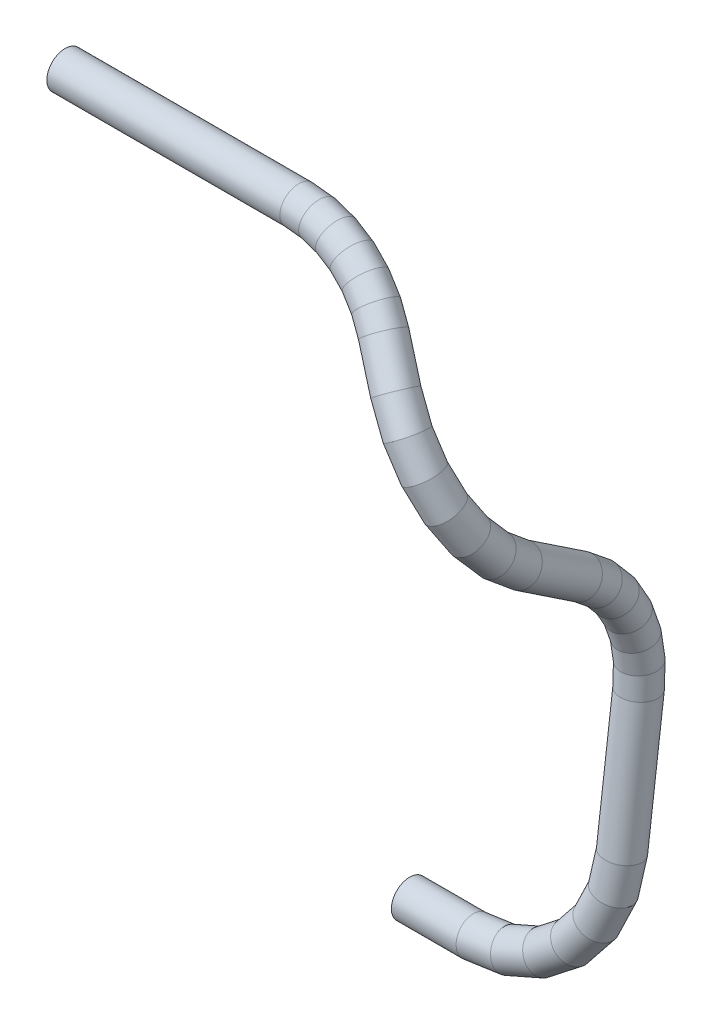
from build123d import *

# Parameters (mm, degrees)
PROFILE_R   = 2.5
PROFILE_R_2 = 1


with BuildPart() as part:
    # Tube: sweep along a curve in space
    with BuildLine() as tube_path:
        Line((-571, 108.371069164, -44.888766616), (-539.067063489, 108.371069164, -44.888766616))
        Line((-539.067063489, 108.371069164, -44.888766616), (-536.278596322, 108.170310961, -44.805609846))
        Line((-536.278596322, 108.170310961, -44.805609846), (-533.55745487, 107.57288353, -44.558147302))
        Line((-533.55745487, 107.57288353, -44.558147302), (-530.969339315, 106.593211363, -44.152353804))
        Line((-530.969339315, 106.593211363, -44.152353804), (-528.576738012, 105.254948006, -43.598026971))
        Line((-528.576738012, 105.254948006, -43.598026971), (-526.437418755, 103.59040495, -42.908550662))
        Line((-526.437418755, 103.59040495, -42.908550662), (-524.603034008, 101.6397715, -42.100571832))
        Line((-524.603034008, 101.6397715, -42.100571832), (-521.147590689, 97.330013466, -40.315411604))
        Line((-521.147590689, 97.330013466, -40.315411604), (-518.693984403, 93.990149126, -39.466326253))
        Line((-518.693984403, 93.990149126, -39.466326253), (-516.469833608, 90.392645824, -39.54967357))
        Line((-516.469833608, 90.392645824, -39.54967357), (-514.597987099, 86.73620814, -40.560849945))
        Line((-514.597987099, 86.73620814, -40.560849945), (-513.181834491, 83.222795839, -42.44400404))
        Line((-513.181834491, 83.222795839, -42.44400404), (-512.29959559, 80.046468819, -45.095121677))
        Line((-512.29959559, 80.046468819, -45.095121677), (-512, 77.382668399, -48.367770964))
        Line((-512, 77.382668399, -48.367770964), (-512, 71.931075288, -56.526656629))
        Line((-512, 71.931075288, -56.526656629), (-512, 69.845298763, -59.099704369))
        Line((-512, 69.845298763, -59.099704369), (-512, 67.323366695, -61.247004306))
        Line((-512, 67.323366695, -61.247004306), (-512, 64.450674804, -62.895846226))
        Line((-512, 64.450674804, -62.895846226), (-512, 61.324495969, -63.990398313))
        Line((-512, 61.324495969, -63.990398313), (-512, 58.05068645, -64.493597688))
        Line((-512, 58.05068645, -64.493597688), (-512, 54.740101463, -64.388405401))
        Line((-512, 54.740101463, -64.388405401), (-512, 36.562012966, -62.124520804))
        Line((-512, 36.562012966, -62.124520804), (-512.613335127, 31.938983826, -61.548772453))
        Line((-512.613335127, 31.938983826, -61.548772453), (-514.411542732, 27.631006483, -61.012260402))
        Line((-514.411542732, 27.631006483, -61.012260402), (-517.272077939, 23.931662472, -60.551547058))
        Line((-517.272077939, 23.931662472, -60.551547058), (-521, 21.093055975, -60.198029276))
        Line((-521, 21.093055975, -60.198029276), (-525.341257188, 19.308633333, -59.975798708))
        Line((-525.341257188, 19.308633333, -59.975798708), (-530, 18.7, -59.9))
        Line((-530, 18.7, -59.9), (-538.85, 18.7, -59.9))
    # Profile → Tube (sweep)
    with BuildSketch(Plane(origin=(-571, 0, 0), x_dir=(0, 0, -1), z_dir=(1, 0, 0))):
        with Locations((44.888766616, 108.371069164)):
            Circle(PROFILE_R)
        with Locations((44.888766616, 108.371069164)):
            Circle(PROFILE_R_2, mode=Mode.SUBTRACT)
    sweep(path=tube_path.line, transition=Transition.RIGHT)


solid = part.part
